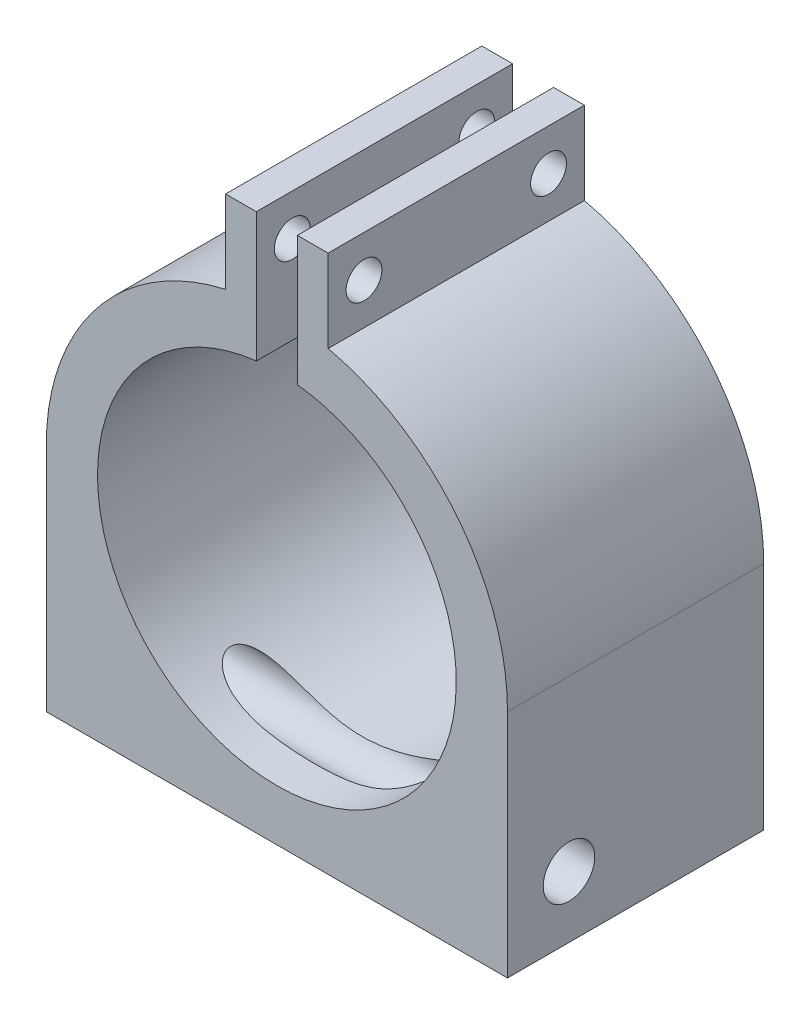
from build123d import *

# Parameters (mm, degrees)
SKETCH1_R           = 22.5
SKETCH1_W           = 10
SKETCH1_H           = 15
SKETCH1_W_2         = 45
SKETCH1_H_2         = 22.5
BOSS_EXTRUDE2_DEPTH = 25
SKETCH3_R           = 17.5
SKETCH3_W           = 4
SKETCH3_H           = 35
CUT_EXTRUDE2_DEPTH  = 25
SKETCH5_R           = 2.513863355
CUT_EXTRUDE3_DEPTH  = 60.581876439
SKETCH7_R           = 1.75
CUT_EXTRUDE4_DEPTH  = 48.762433046


with BuildPart() as part:
    # Sketch1 → Boss-Extrude2 (new body)
    with BuildSketch(Plane.XY):
        Circle(SKETCH1_R)
        with Locations((0, 22.5)):
            Rectangle(SKETCH1_W, SKETCH1_H)
        with Locations((0, -11.25)):
            Rectangle(SKETCH1_W_2, SKETCH1_H_2)
    extrude(amount=BOSS_EXTRUDE2_DEPTH)

    # Sketch3 → Cut-Extrude2 (cut)
    with BuildSketch(Plane.XY.offset(25)):
        Circle(SKETCH3_R)
        with Locations((0, 17.5)):
            Rectangle(SKETCH3_W, SKETCH3_H)
    extrude(amount=-CUT_EXTRUDE2_DEPTH, mode=Mode.SUBTRACT)

    # Sketch5 → Cut-Extrude3 (cut, through all)
    with BuildSketch(Plane.ZY.offset(22.5)):
        with Locations((19, -16.5)):
            Circle(SKETCH5_R)
    extrude(amount=-CUT_EXTRUDE3_DEPTH, mode=Mode.SUBTRACT)

    # Sketch7 → Cut-Extrude4 (cut, through all)
    with BuildSketch(Plane.ZY.offset(5)):
        with Locations(Location((3.5, 25.968705484, 0), (0, 0, 270))):
            Circle(SKETCH7_R)
        with Locations(Location((21.5, 25.968705484, 0), (0, 0, 270))):
            Circle(SKETCH7_R)
    extrude(amount=-CUT_EXTRUDE4_DEPTH, mode=Mode.SUBTRACT)


solid = part.part
